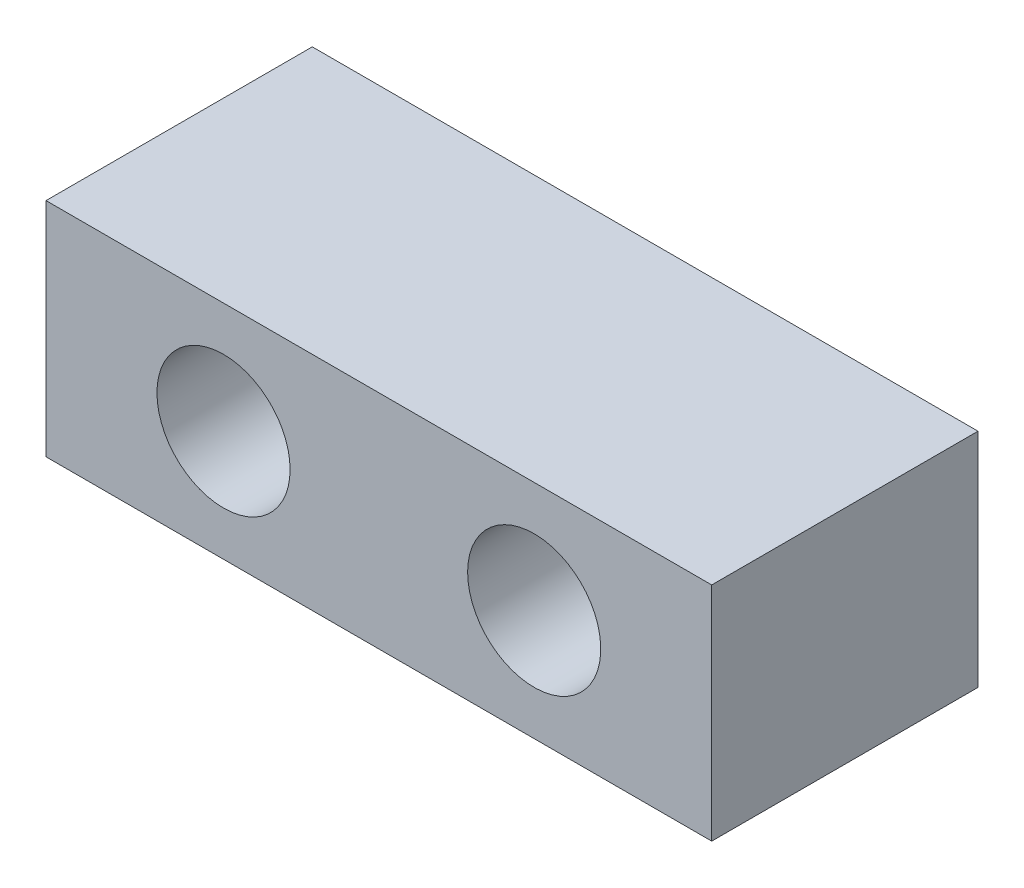
from build123d import *

# Parameters (mm, degrees)
ESQUISSE1_W                  = 30
ESQUISSE1_H                  = 10
BOSS_EXTRU_1_DEPTH           = 12
ENL_V_MAT_EXTRU_1_DEPTH      = 34.823069051
ENL_V_MAT_EXTRU_1_DEPTH_BACK = 34.823069051
ESQUISSE2_R                  = 3


with BuildPart() as part:
    # Esquisse1 → Boss.-Extru.1 (new body)
    with BuildSketch(Plane.XY):
        with Locations((15, 5)):
            Rectangle(ESQUISSE1_W, ESQUISSE1_H)
    extrude(amount=BOSS_EXTRU_1_DEPTH)

    # Esquisse2 → Enlèv. mat.-Extru.1 (cut, two sides: drawn at the far end of the back side and taken through both)
    with BuildSketch(Plane.XY.offset(12).offset(-ENL_V_MAT_EXTRU_1_DEPTH_BACK)):
        with Locations((8, 5)):
            Circle(ESQUISSE2_R)
        with Locations(Location((22, 5, 0), (0, 0, 180))):
            Circle(ESQUISSE2_R)
    extrude(amount=ENL_V_MAT_EXTRU_1_DEPTH + ENL_V_MAT_EXTRU_1_DEPTH_BACK, mode=Mode.SUBTRACT)


solid = part.part
